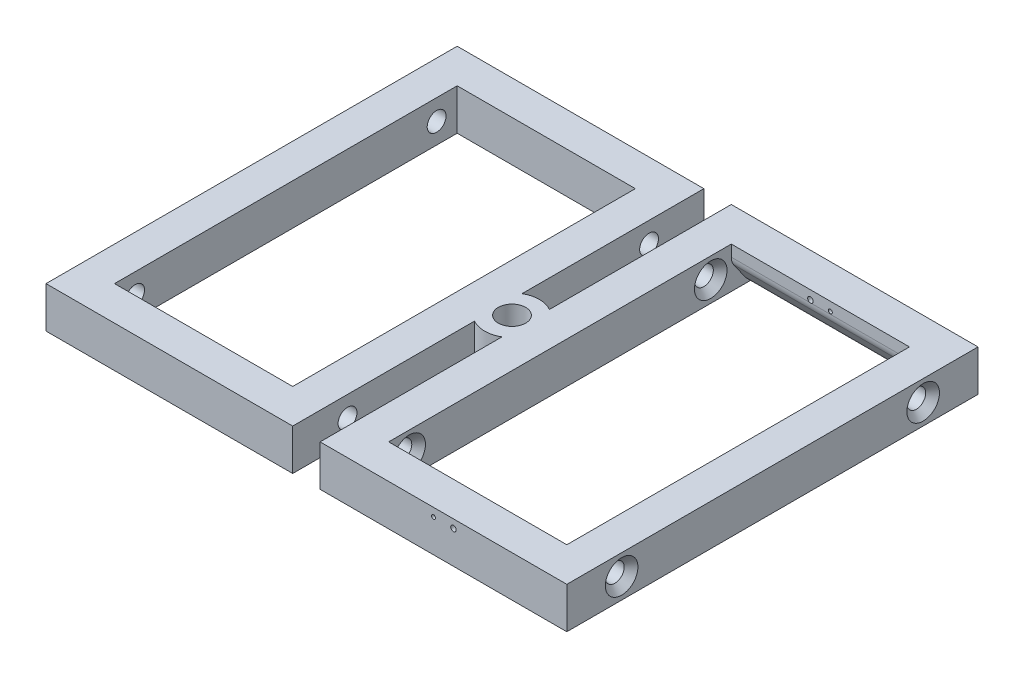
from build123d import *

# Parameters (mm, degrees)
SKETCH3_R           = 10.16
SKETCH3_R_2         = 5.08
SKETCH3_W           = 91.44
SKETCH3_H           = 152.4
SKETCH3_W_2         = 66.04
SKETCH3_H_2         = 127
BOSS_EXTRUDE1_DEPTH = 15.24
CUT_EXTRUDE1_REACH  = 122
SKETCH4_R           = 3.4925
CHAMFER1_SIZE       = 6.604
CHAMFER1_SIZE2      = 9.431489437
CHAMFER2_SIZE       = 2.54
FILLET1_R           = 5.08
SKETCH5_RX          = 0.7366
SKETCH5_RY          = 0.736599138
CUT_EXTRUDE2_DEPTH  = 12.7
SKETCH6_R           = 1.015962928
SKETCH6_RX          = 0.7366
SKETCH6_RY          = 0.736573123
CUT_EXTRUDE3_DEPTH  = 12.7


with BuildPart() as part:
    # Sketch3 → Boss-Extrude1 (new body)
    # profile 1 of 2: a face of its own
    with BuildSketch(Plane(origin=(0, 0, 0), x_dir=(1, 0, 0), z_dir=(0, 1, 0))):
        Circle(SKETCH3_R)
        with Locations(Location((0, 0, 0), (0, 0, 90))):
            Circle(SKETCH3_R_2, mode=Mode.SUBTRACT)
    # profile 2 of 2: a face of its own
    with BuildSketch(Plane(origin=(0, 0, 0), x_dir=(1, 0, 0), z_dir=(0, 1, 0))):
        with Locations((50.8, 0)):
            Rectangle(SKETCH3_W, SKETCH3_H)
        with Locations((50.8, 0)):
            Rectangle(SKETCH3_W_2, SKETCH3_H_2, mode=Mode.SUBTRACT)
    boss_extrude1 = extrude(amount=BOSS_EXTRUDE1_DEPTH)

    # Cut-Extrude1: up to this face of the body (flat: up to its plane)
    cut_extrude1_end = Plane(part.part.faces().sort_by_distance((96.52, 7.62, 0))[0])
    # Sketch4 → Cut-Extrude1 (cut, up to the picked face)
    with BuildSketch(Plane.ZY.offset(-5.08), mode=Mode.PRIVATE) as cut_extrude1_sk1:
        with Locations((-55.88, 7.62)):
            Circle(SKETCH4_R)
    cut_extrude1_tool1 = split(extrude(cut_extrude1_sk1.sketch, amount=-CUT_EXTRUDE1_REACH, mode=Mode.PRIVATE), bisect_by=cut_extrude1_end, keep=Keep.BOTH, mode=Mode.PRIVATE)
    # Sketch4 → Cut-Extrude1 (cut, up to the picked face)
    with BuildSketch(Plane.ZY.offset(-5.08), mode=Mode.PRIVATE) as cut_extrude1_sk2:
        with Locations((55.88, 7.62)):
            Circle(SKETCH4_R)
    cut_extrude1_tool2 = split(extrude(cut_extrude1_sk2.sketch, amount=-CUT_EXTRUDE1_REACH, mode=Mode.PRIVATE), bisect_by=cut_extrude1_end, keep=Keep.BOTH, mode=Mode.PRIVATE)
    cut_extrude1_1 = cut_extrude1_tool1.solids().sort_by(Axis((5.08, 7.62, -55.88), (1, 0, 0)))[0]
    add(cut_extrude1_1, mode=Mode.SUBTRACT)
    cut_extrude1_2 = cut_extrude1_tool2.solids().sort_by(Axis((5.08, 7.62, 55.88), (1, 0, 0)))[0]
    add(cut_extrude1_2, mode=Mode.SUBTRACT)
    cut_extrude1 = cut_extrude1_1 + cut_extrude1_2  # Cut-Extrude1 as one shape, for the pattern or mirror that repeats it

    # Chamfer1
    chamfer1_edges = [part.edges().sort_by_distance(p)[0] for p in [
        (50.8, 0, -63.5),
        (50.8, 0, 63.5),
    ]]
    chamfer1_side = [part.faces().sort_by_distance(p)[0] for p in [
        (94.659720924, 0, 0),
    ]]
    chamfer(chamfer1_edges, length=CHAMFER1_SIZE, length2=CHAMFER1_SIZE2, reference=chamfer1_side[0])

    # Chamfer2
    chamfer2_edges = [part.edges().sort_by_distance(p)[0] for p in [
        (96.52, 7.62, -59.3725),
        (17.78, 7.62, -59.3725),
        (96.52, 7.62, 52.3875),
        (17.78, 7.62, 52.3875),
    ]]
    chamfer(chamfer2_edges, length=CHAMFER2_SIZE)

    # Fillet1
    fillet1_edges = [part.edges().sort_by_distance(p)[0] for p in [
        (50.8, 9.431489437, 63.5),
        (50.8, 0, -70.104),
        (50.8, 0, 70.104),
        (50.8, 9.431489437, -63.5),
    ]]
    fillet(fillet1_edges, radius=FILLET1_R)

    # Sketch5 → Cut-Extrude2 (cut)
    with BuildSketch(Plane.XY.offset(-63.5)):
        with BuildLine():
            ThreePointArc((47.502994006, 11.033207367), (47.953744135, 11.407651091), (48.122732414, 11.968745328))
            ThreePointArc((48.122732414, 11.968745328), (47.473130673, 12.916377519), (46.355000482, 12.652229708))
            ThreePointArc((46.355000482, 12.652229708), (46.090734793, 11.968745328), (46.355000482, 11.285260949))
            ThreePointArc((46.355000482, 11.285260949), (46.519064449, 11.139951899), (46.710473201, 11.033207367))
            Line((46.710473165, 11.033207284), (47.502994041, 11.033207284))
        make_face()
        with BuildLine():
            ThreePointArc((46.710473201, 11.033207367), (47.106733603, 10.952746518), (47.502994006, 11.033207367))
            Line((47.502994041, 11.033207284), (46.710473165, 11.033207284))
        make_face()
        with Locations(Location((54.472733603, 11.968745328), (0, 0, -180))):
            Ellipse(SKETCH5_RX, SKETCH5_RY)
    extrude(amount=-CUT_EXTRUDE2_DEPTH, mode=Mode.SUBTRACT)

    # Sketch6 → Cut-Extrude3 (cut)
    with BuildSketch(Plane(origin=(0, 0, 63.5), x_dir=(-1, 0, 0), z_dir=(0, 0, -1))):
        with Locations((-54.493266397, 12.147267432)):
            Circle(SKETCH6_R)
        with Locations(Location((-47.127266397, 12.147267432), (0, 0, 0))):
            Ellipse(SKETCH6_RX, SKETCH6_RY)
    extrude(amount=-CUT_EXTRUDE3_DEPTH, mode=Mode.SUBTRACT)

    # Mirror1: Boss-Extrude1, Cut-Extrude1 across plane
    add(boss_extrude1.mirror(Plane(origin=(0, 0, 0), x_dir=(0, 0, 1), z_dir=(1, 0, 0))))
    add(cut_extrude1.mirror(Plane(origin=(0, 0, 0), x_dir=(0, 0, 1), z_dir=(1, 0, 0))), mode=Mode.SUBTRACT)


solid = part.part
